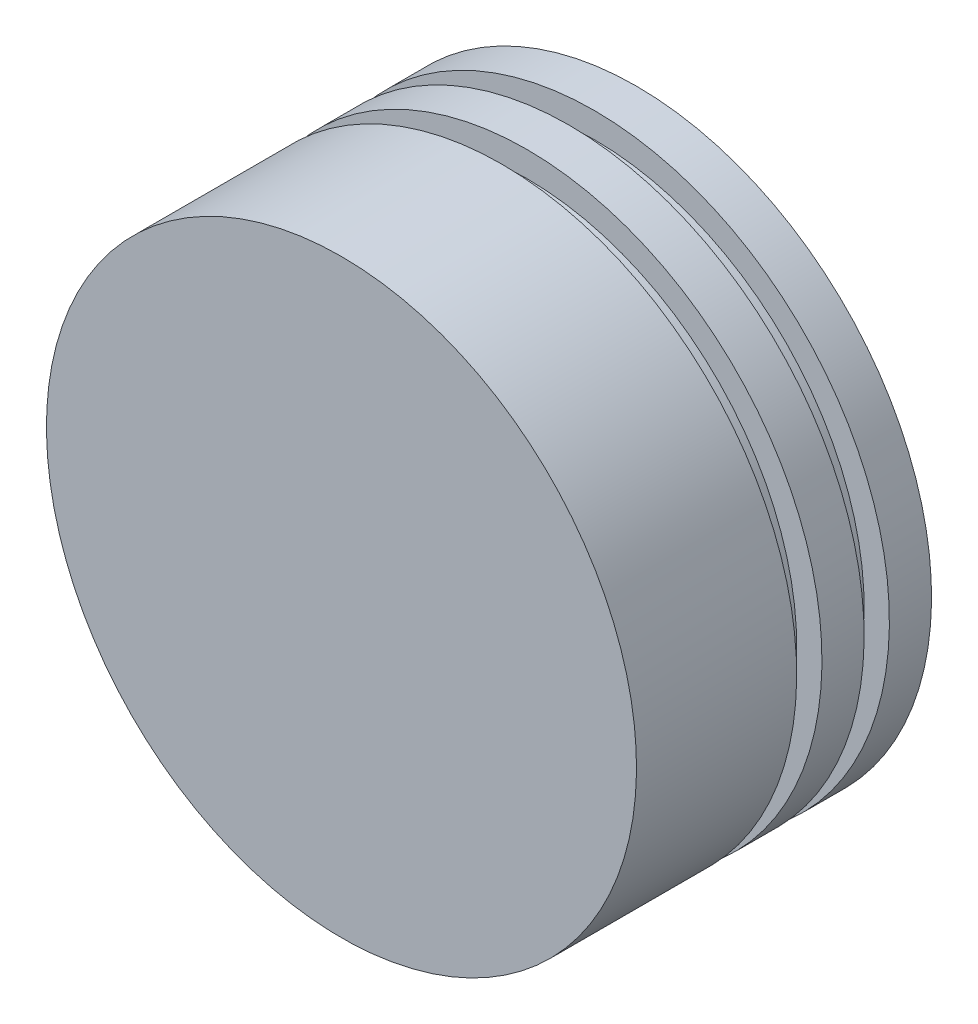
from build123d import *

# Parameters (mm, degrees)
BOSS_EXTRUDE4_REACH = 79.782
SKETCH4_R           = 25
SKETCH5_R           = 24
CUT_EXTRUDE5_DEPTH  = 15


with BuildPart() as part:
    # Sketch1 → Revolve1 (revolve)
    with BuildSketch(Plane(origin=(0, 0, 0), x_dir=(0, 0, -1), z_dir=(1, 0, 0)), mode=Mode.PRIVATE) as revolve1_sk:
        Polygon((0, 0), (0, -10), (19, -10), (19, -7), (22, -7), (22, -10), (27, -10), (27, -7), (30, -7), (30, -10), (35, -10), (35, 25), (15, 25), (15, 0), align=None)
    revolve(revolve1_sk.sketch.rotate(Axis((0, 25, -35), (0, 0, 1)), 180), axis=Axis((0, 25, -35), (0, 0, 1)))

    # Sketch4 → Boss-Extrude4 (add, up to next)
    with BuildSketch(Plane.XY, mode=Mode.PRIVATE) as boss_extrude4_sk1:
        with Locations((0, 25)):
            Circle(SKETCH4_R)
    boss_extrude4_tool1 = extrude(boss_extrude4_sk1.sketch, amount=-BOSS_EXTRUDE4_REACH, mode=Mode.PRIVATE) - part.part
    add(boss_extrude4_tool1.solids().sort_by_distance((0, 25, 0))[0])

    # Sketch5 → Cut-Extrude5 (cut)
    with BuildSketch(Plane(origin=(0, 0, -35), x_dir=(-1, 0, 0), z_dir=(0, 0, -1))):
        with Locations(Location((0, 25, 0), (0, 0, 90))):
            Circle(SKETCH5_R)
    extrude(amount=-CUT_EXTRUDE5_DEPTH, mode=Mode.SUBTRACT)


solid = part.part
